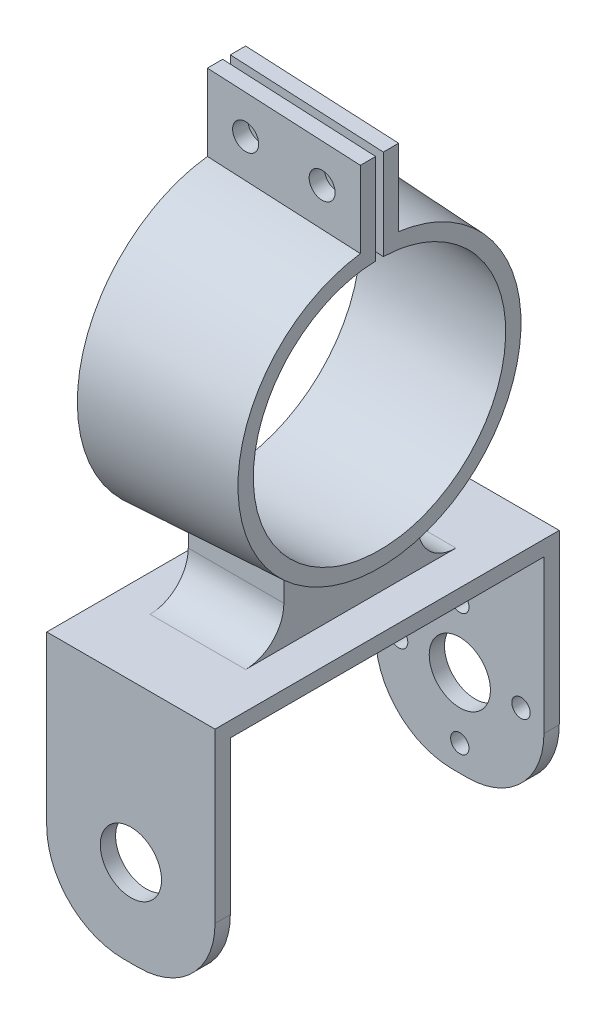
from build123d import *

# Parameters (mm, degrees)
SKETCH3_R           = 1.7
CUT_EXTRUDE1_DEPTH  = 10
SKETCH4_W           = 22
SKETCH4_H           = 45
BOSS_EXTRUDE1_DEPTH = 2
BOSS_EXTRUDE3_REACH = 64.45
SKETCH6_W           = 12.5
SKETCH6_H           = 17.5
SKETCH7_W           = 22
SKETCH7_H           = 2
BOSS_EXTRUDE4_DEPTH = 30
SKETCH8_R           = 4
CUT_EXTRUDE2_DEPTH  = 76.59761901
SKETCH9_R           = 1.2
CUT_EXTRUDE3_DEPTH  = 30
FILLET1_R           = 10
FILLET2_R           = 5


with BuildPart() as part:
    # Sketch2 → Loft1 section 0
    with BuildSketch(Plane(origin=(20, 0, 0), x_dir=(0, 0, -1), z_dir=(1, 0, 0))):
        with BuildLine():
            Line((-2.5, 18.332586185), (-2.5, 28.332586185))
            Line((-2.5, 28.332586185), (-0.5, 28.332586185))
            Line((-0.5, 28.332586185), (-0.5, 16.492422502))
            ThreePointArc((-0.5, 16.492422502), (0, -16.5), (0.5, 16.492422502))
            Line((0.5, 16.492422502), (0.5, 28.332586185))
            Line((0.5, 28.332586185), (2.5, 28.332586185))
            Line((2.5, 28.332586185), (2.5, 18.332586185))
            ThreePointArc((2.5, 18.332586185), (0, -18.502262463), (-2.5, 18.332586185))
        make_face()
    # Sketch1 → Loft1 section 1
    with BuildSketch(Plane(origin=(0, 0, 0), x_dir=(0, 0, -1), z_dir=(1, 0, 0))):
        with BuildLine():
            Line((-2.5, 19.339079606), (-2.5, 29.339079606))
            Line((-2.5, 29.339079606), (-0.502358537, 29.339079606))
            Line((-0.502358537, 29.339079606), (-0.502358537, 17.492788111))
            ThreePointArc((-0.502358537, 17.492788111), (0, -17.5), (0.502358537, 17.492788111))
            Line((0.502358537, 17.492788111), (0.502358537, 29.339079606))
            Line((0.502358537, 29.339079606), (2.5, 29.339079606))
            Line((2.5, 29.339079606), (2.5, 19.339079606))
            ThreePointArc((2.5, 19.339079606), (0, -19.5), (-2.5, 19.339079606))
        make_face()
    loft()

    # Sketch3 → Cut-Extrude1 (cut)
    with BuildSketch(Plane(origin=(0, 0, -2.5), x_dir=(-1, 0, 0), z_dir=(0, 0, -1))):
        with Locations((-15, 23.577882113)):
            Circle(SKETCH3_R)
        with Locations((-5, 24.081128823)):
            Circle(SKETCH3_R)
    extrude(amount=-CUT_EXTRUDE1_DEPTH, mode=Mode.SUBTRACT)

    # Sketch6 → Boss-Extrude3 (add, up to next)
    with BuildSketch(Plane(origin=(0, -25, 0), x_dir=(1, 0, 0), z_dir=(0, 1, 0)), mode=Mode.PRIVATE) as boss_extrude3_sk1:
        with Locations((10, 0)):
            Rectangle(SKETCH6_W, SKETCH6_H)
    boss_extrude3_tool1 = extrude(boss_extrude3_sk1.sketch, amount=BOSS_EXTRUDE3_REACH, mode=Mode.PRIVATE) - part.part


with BuildPart() as body_2:
    # Sketch4 → Boss-Extrude1 (new body)
    with BuildSketch(Plane(origin=(0, -25, 0), x_dir=(1, 0, 0), z_dir=(0, 1, 0))):
        with Locations((10, 0)):
            Rectangle(SKETCH4_W, SKETCH4_H)
    extrude(amount=-BOSS_EXTRUDE1_DEPTH)


with BuildPart() as part_1:
    add(part.part)

    add(body_2.part)  # Boss-Extrude3 merges body 2
    add(boss_extrude3_tool1.solids().sort_by_distance((10, -25, 0))[0])

    # Sketch7 → Boss-Extrude4 (add)
    with BuildSketch(Plane.XZ.offset(27)):
        with Locations((10, 21.5)):
            Rectangle(SKETCH7_W, SKETCH7_H)
        with Locations((10, -21.5)):
            Rectangle(SKETCH7_W, SKETCH7_H)
    extrude(amount=BOSS_EXTRUDE4_DEPTH)

    # Sketch8 → Cut-Extrude2 (cut, through all)
    with BuildSketch(Plane.XY.offset(22.5)):
        with Locations(Location((10, -45.591327039, 0), (0, 0, 180))):
            Circle(SKETCH8_R)
    extrude(amount=-CUT_EXTRUDE2_DEPTH, mode=Mode.SUBTRACT)

    # Sketch9 → Cut-Extrude3 (cut)
    with BuildSketch(Plane(origin=(0, 0, -22.5), x_dir=(-1, 0, 0), z_dir=(0, 0, -1))):
        with Locations((-10, -37.591327039)):
            Circle(SKETCH9_R)
        with Locations((-2, -45.591327039)):
            Circle(SKETCH9_R)
        with Locations((-10, -53.591327039)):
            Circle(SKETCH9_R)
        with Locations((-18, -45.591327039)):
            Circle(SKETCH9_R)
    extrude(amount=-CUT_EXTRUDE3_DEPTH, mode=Mode.SUBTRACT)

    # Fillet1
    fillet1_edges = [part_1.edges().sort_by_distance(p)[0] for p in [
        (21, -57, -21.5),
        (-1, -57, 21.5),
        (21, -57, 21.5),
        (-1, -57, -21.5),
    ]]
    fillet(fillet1_edges, radius=FILLET1_R)

    # Fillet2
    fillet2_edges = [part_1.edges().sort_by_distance(p)[0] for p in [
        (10, -25, -8.75),
        (10, -25, 8.75),
    ]]
    fillet(fillet2_edges, radius=FILLET2_R)


solid = part_1.part
